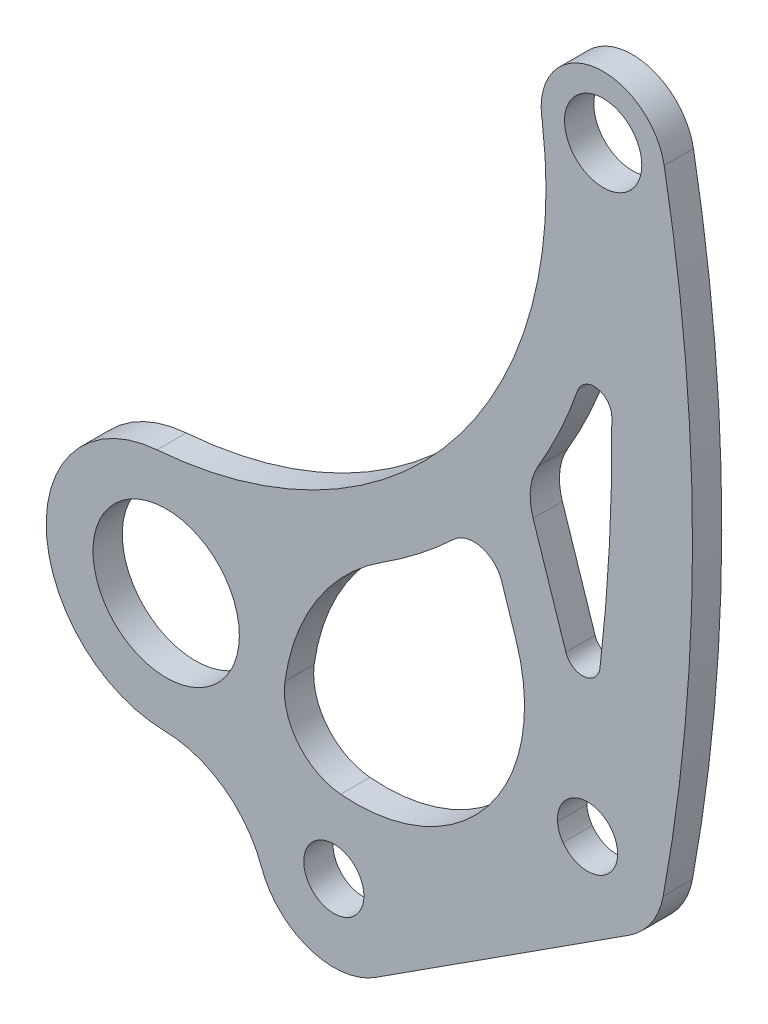
from build123d import *

# Parameters (mm, degrees)
SKETCH2_R           = 7.9375
SKETCH2_R_2         = 3.2639
SKETCH2_R_3         = 4.191
BOSS_EXTRUDE1_DEPTH = 3.175
FILLET3_R           = 1.905
FILLET4_R           = 6.35
BOSS_EXTRUDE2_START = -3.175
BOSS_EXTRUDE2_DEPTH = 3.175
CUT_EXTRUDE1_DEPTH  = 12.065
FILLET5_R           = 3.175
CUT_EXTRUDE4_DEPTH  = 93.540316773


with BuildPart() as part:
    # Sketch2 → Boss-Extrude1 (new body)
    with BuildSketch(Plane.XY):
        with BuildLine():
            Line((22.709173353, -24.74146542), (50.237344688, -7.01528789))
            ThreePointArc((50.237344688, -7.01528789), (52.649254226, -4.648236557), (53.924522204, -1.51871084))
            ThreePointArc((53.924522204, -1.51871084), (57.106411985, 32.846575037), (54.035830718, 67.22198524))
            ThreePointArc((54.035830718, 67.22198524), (46.044632155, 72.608660166), (40.859194914, 64.485436554))
            Line((40.859194914, 64.485436554), (40.833827284, 64.453346951))
            ThreePointArc((40.833827284, 64.453346951), (30.975387354, 29.729811242), (-0.998479041, 12.979150429))
            ThreePointArc((-0.998479041, 12.979150429), (-12.595568055, 3.287395871), (-7.214067166, -10.835706769))
            Line((-7.214067166, -10.835706769), (13.567787564, -24.671601284))
            ThreePointArc((13.567787564, -24.671601284), (18.128061271, -26.069833859), (22.709173353, -24.74146542))
        make_face()
        Circle(SKETCH2_R, mode=Mode.SUBTRACT)
        with Locations((18.191828664, -17.726177531)):
            Circle(SKETCH2_R_2, mode=Mode.SUBTRACT)
        with Locations((45.72, 0)):
            Circle(SKETCH2_R_2, mode=Mode.SUBTRACT)
        with BuildLine():
            Line((40.584986991, 6.617553577), (21.318666843, -5.788581474))
            Line((21.318666843, -5.788581474), (11.074870198, -6.841239387))
            ThreePointArc((11.074870198, -6.841239387), (12.976194182, 1.036190528), (9.848859751, 8.512066016))
            ThreePointArc((9.848859751, 8.512066016), (23.445327069, 14.632175726), (34.749899024, 24.354640398))
            Line((34.749899024, 24.354640398), (40.584986991, 6.617553577))
        make_face(mode=Mode.SUBTRACT)
        with BuildLine():
            ThreePointArc((47.523781163, 56.501393309), (48.257752726, 32.370804269), (45.933946154, 8.34115665))
            Line((45.933946154, 8.34115665), (38.882442516, 29.775817606))
            ThreePointArc((38.882442516, 29.775817606), (45.039190515, 42.544935267), (47.523781163, 56.501393309))
        make_face(mode=Mode.SUBTRACT)
        with Locations((47.413333333, 66.018287029)):
            Circle(SKETCH2_R_3, mode=Mode.SUBTRACT)
    extrude(amount=BOSS_EXTRUDE1_DEPTH)

    # Fillet3
    fillet3_edges = [part.edges().sort_by_distance(p)[0] for p in [
        (45.933946154, 8.34115665, 1.5875),
        (47.523781163, 56.501393309, 1.5875),
    ]]
    fillet(fillet3_edges, radius=FILLET3_R)

    # Fillet4
    fillet4_edges = [part.edges().sort_by_distance(p)[0] for p in [
        (38.882442516, 29.775817606, 1.5875),
    ]]
    fillet(fillet4_edges, radius=FILLET4_R)

    # Sketch3 → Boss-Extrude2 (add)
    with BuildSketch(Plane.XY.offset(3.175).offset(BOSS_EXTRUDE2_START)):
        with BuildLine():
            ThreePointArc((37.967247274, 14.574773228), (38.850624387, 9.974362656), (38.539279751, 5.300264126))
            Line((38.539279751, 5.300264126), (40.584986991, 6.617553577))
            Line((40.584986991, 6.617553577), (37.967247274, 14.574773228))
        make_face()
        with BuildLine():
            ThreePointArc((14.005375904, -6.540099084), (13.004272705, -4.28056917), (12.890798124, -1.811802966))
            ThreePointArc((12.890798124, -1.811802966), (12.243860592, -4.42076736), (11.074870198, -6.841239387))
            Line((11.074870198, -6.841239387), (14.005375904, -6.540099084))
        make_face()
        with BuildLine():
            ThreePointArc((9.848859751, 8.512066016), (12.486736073, 3.679229335), (12.890798124, -1.811802966))
            ThreePointArc((12.890798124, -1.811802966), (16.379474961, 7.582660649), (23.480082515, 14.654307207))
            ThreePointArc((23.480082515, 14.654307207), (16.886076234, 11.091387544), (9.848859751, 8.512066016))
        make_face()
    extrude(amount=BOSS_EXTRUDE2_DEPTH)

    # Sketch4 → Cut-Extrude1 (cut)
    with BuildSketch(Plane.XY):
        with BuildLine():
            Line((38.539279751, 5.300264126), (24.727997063, 1.47053375))
            ThreePointArc((24.727997063, 1.47053375), (25.836206507, -0.508508416), (26.220294441, -2.743953008))
            ThreePointArc((26.220294441, -2.743953008), (24.044282761, -7.68479904), (18.930249644, -9.41501626))
            ThreePointArc((18.930249644, -9.41501626), (30.477911362, -6.56779892), (37.848176473, 2.766778194))
            ThreePointArc((37.848176473, 2.766778194), (38.239149826, 4.021130685), (38.539279751, 5.300264126))
        make_face()
        with BuildLine():
            ThreePointArc((24.727997063, 1.47053375), (17.733373474, 3.709866579), (12.890798123, -1.811802972))
            Line((12.890798123, -1.811802972), (24.727997063, 1.47053375))
        make_face()
        with BuildLine():
            Line((24.727997063, 1.47053375), (12.890798123, -1.811802972))
            ThreePointArc((12.890798123, -1.811802972), (14.27873169, -6.909589201), (18.930249644, -9.41501626))
            ThreePointArc((18.930249644, -9.41501626), (24.044282761, -7.68479904), (26.220294441, -2.743953008))
            ThreePointArc((26.220294441, -2.743953008), (25.836206507, -0.508508416), (24.727997063, 1.47053375))
        make_face()
    extrude(amount=CUT_EXTRUDE1_DEPTH, mode=Mode.SUBTRACT)

    # Fillet5
    fillet5_edges = [part.edges().sort_by_distance(p)[0] for p in [
        (34.749899024, 24.354640398, 1.5875),
    ]]
    fillet(fillet5_edges, radius=FILLET5_R)

    # Sketch7 → Cut-Extrude4 (cut, through all)
    with BuildSketch(Plane.XY.offset(3.175)):
        with BuildLine():
            Line((-7.214067166, -10.835706769), (-10.643189811, -19.50399936))
            Line((-10.643189811, -19.50399936), (10.339065437, -28.238529248))
            Line((10.339065437, -28.238529248), (13.567787564, -24.671601284))
            ThreePointArc((13.567787564, -24.671601284), (11.621320872, -22.869045851), (10.339065437, -20.546598936))
            ThreePointArc((10.339065437, -20.546598936), (6.247008791, -15.136046815), (-0.196937719, -13.01601021))
            ThreePointArc((-0.196937719, -13.01601021), (-3.862535324, -12.431256056), (-7.214067166, -10.835706769))
        make_face()
    extrude(amount=-CUT_EXTRUDE4_DEPTH, mode=Mode.SUBTRACT)


solid = part.part
